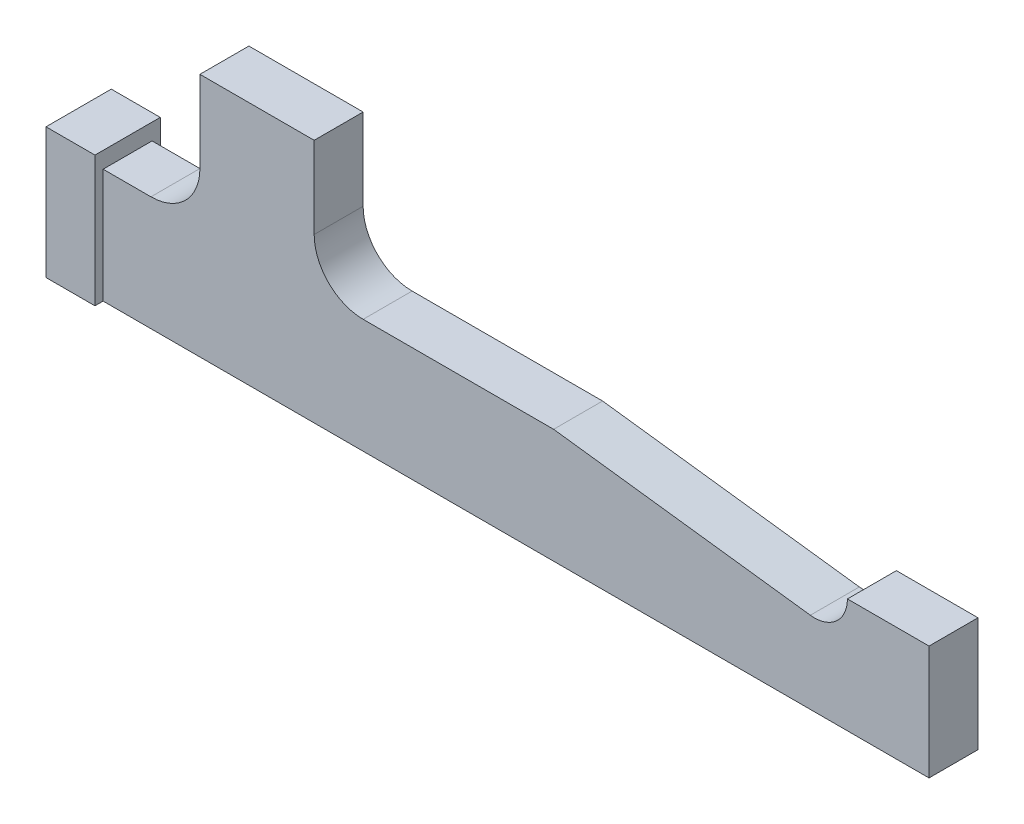
from build123d import *

# Parameters (mm, degrees)
BOSS_EXTRUDE1_DEPTH = 1.5
BOSS_EXTRUDE2_DEPTH = 2


with BuildPart() as part:
    # Sketch1 → Boss-Extrude1 (new, symmetric)
    with BuildSketch(Plane.XY):
        with BuildLine():
            Line((-50.6, 0), (0, 0))
            Line((0, 0), (0, 7))
            Line((0, 7), (-5, 7))
            ThreePointArc((-5, 7), (-5.683439754, 5.487162066), (-7.270399626, 5))
            Line((-7.270399626, 5), (-23, 7))
            Line((-23, 7), (-34.67, 7))
            ThreePointArc((-34.67, 7), (-36.791320344, 7.878679656), (-37.67, 10))
            Line((-37.67, 10), (-37.67, 15))
            Line((-37.67, 15), (-44.67, 15))
            Line((-44.67, 15), (-44.67, 10))
            ThreePointArc((-44.67, 10), (-45.548679656, 7.878679656), (-47.67, 7))
            Line((-47.67, 7), (-50.6, 7))
            Line((-50.6, 7), (-50.6, 0))
        make_face()
    extrude(amount=BOSS_EXTRUDE1_DEPTH, both=True)

    # Sketch1<6> → Boss-Extrude2 (add, symmetric)
    with BuildSketch(Plane.XY):
        Polygon((-53.6, 0), (-50.6, 0), (-50.6, 7), (-50.6, 8), (-53.6, 8), align=None)
    extrude(amount=BOSS_EXTRUDE2_DEPTH, both=True)


solid = part.part
